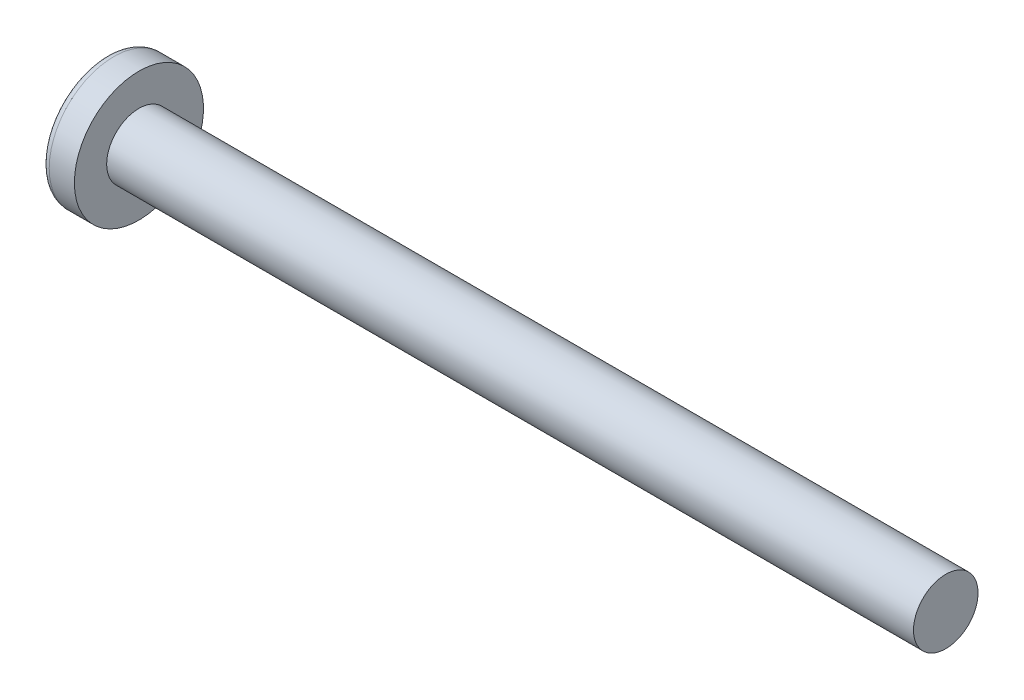
from build123d import *

# Parameters (mm, degrees)
CIRPATTERN1_COUNT = 2
CIRPATTERN1_ANGLE = 90


with BuildPart() as part:
    # BodySke → Base-Revolve (revolve)
    with BuildSketch(Plane.XY, mode=Mode.PRIVATE) as base_revolve_sk:
        with BuildLine():
            Line((1.6, 1), (1.6, 2))
            Line((1.6, 2), (0.820084035, 2))
            ThreePointArc((0.820084035, 2), (0.712029995, 1.974299613), (0.627117876, 1.902702703))
            ThreePointArc((0.627117876, 1.902702703), (0.160820604, 1.001692868), (0, 0))
            Line((0, 0), (26.6, 0))
            Line((26.6, 0), (26.6, 1))
            Line((26.6, 1), (1.6, 1))
        make_face()
    revolve(base_revolve_sk.sketch.rotate(Axis((-25.4, 0, 0), (1, 0, 0)), 90), axis=Axis((-25.4, 0, 0), (1, 0, 0)))

    # Sketch3 → Cut-Loft1 section 0
    with BuildSketch(Plane(origin=(0, 0, 0), x_dir=(0, 0, -1), z_dir=(1, 0, 0))):
        with BuildLine():
            Line((0.24, -0.91), (-0.24, -0.91))
            Line((-0.24, -0.91), (-0.24, 0.91))
            Line((-0.24, 0.91), (0.24, 0.91))
            Line((0.24, 0.91), (0.24, -0.91))
        make_face()
    # Sketch4 → Cut-Loft1 section 1
    with BuildSketch(Plane(origin=(1.19, 0, 0), x_dir=(0, 0, -1), z_dir=(1, 0, 0))):
        with BuildLine():
            Line((0.12, -0.12), (-0.12, -0.12))
            Line((-0.12, -0.12), (-0.12, 0.12))
            Line((-0.12, 0.12), (0.12, 0.12))
            Line((0.12, 0.12), (0.12, -0.12))
        make_face()
    cut_loft1 = loft(mode=Mode.SUBTRACT)

    # CirPattern1: Cut-Loft1 ×2 about axis
    cirpattern1_axis = Axis((0, 0, 0), (1, 0, 0))
    for i in range(1, CIRPATTERN1_COUNT):
        add(cut_loft1.rotate(cirpattern1_axis, i * CIRPATTERN1_ANGLE / (CIRPATTERN1_COUNT - 1)), mode=Mode.SUBTRACT)


solid = part.part
